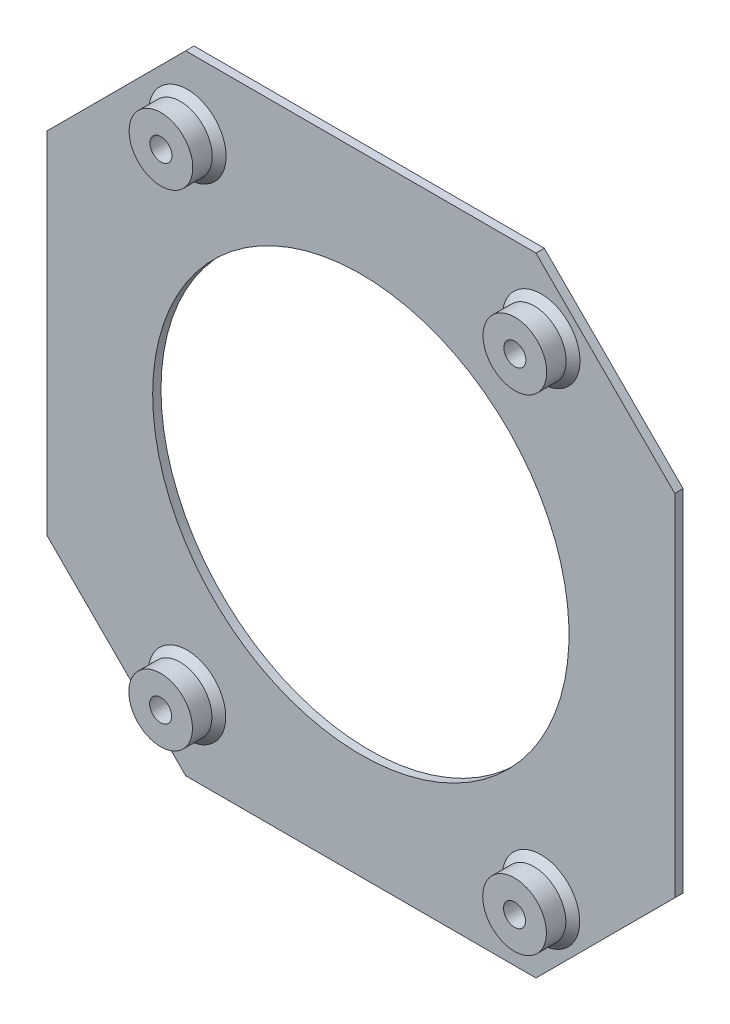
from build123d import *

# Parameters (mm, degrees)
SKETCH2_W           = 90.475
SKETCH2_H           = 1.2
BOSS_EXTRUDE1_DEPTH = 90.475
SKETCH3_R           = 4.587496825
SKETCH3_R_2         = 1.587496825
EXTRUDE_THIN1_DEPTH = 3.8
CHAMFER1_SIZE       = 1
SKETCH5_R           = 30
CUT_EXTRUDE1_DEPTH  = 106.553838455
CHAMFER2_SIZE       = 20


with BuildPart() as part:
    # Sketch2 → Boss-Extrude1 (new body)
    with BuildSketch(Plane(origin=(0, 4.7625, 0), x_dir=(1, 0, 0), z_dir=(0, 1, 0))):
        with Locations((0, -0.6)):
            Rectangle(SKETCH2_W, SKETCH2_H)
    extrude(amount=BOSS_EXTRUDE1_DEPTH)

    # Sketch3 → Extrude-Thin1 (add)
    # profile 1 of 4: a face of its own
    with BuildSketch(Plane(origin=(0, 0, 5), x_dir=(-1, 0, 0), z_dir=(0, 0, -1))):
        with Locations((25.003889322, 84.960201446)):
            Circle(SKETCH3_R)
        with Locations((25.003889322, 84.960201446)):
            Circle(SKETCH3_R_2, mode=Mode.SUBTRACT)
    # profile 2 of 4: a face of its own
    with BuildSketch(Plane(origin=(0, 0, 5), x_dir=(-1, 0, 0), z_dir=(0, 0, -1))):
        with Locations((-25.995997859, 84.926982308)):
            Circle(SKETCH3_R)
        with Locations((-25.995997859, 84.926982308)):
            Circle(SKETCH3_R_2, mode=Mode.SUBTRACT)
    # profile 3 of 4: a face of its own
    with BuildSketch(Plane(origin=(0, 0, 5), x_dir=(-1, 0, 0), z_dir=(0, 0, -1))):
        with Locations((25.049484218, 14.960356296)):
            Circle(SKETCH3_R)
        with Locations((25.049484218, 14.960356296)):
            Circle(SKETCH3_R_2, mode=Mode.SUBTRACT)
    # profile 4 of 4: a face of its own
    with BuildSketch(Plane(origin=(0, 0, 5), x_dir=(-1, 0, 0), z_dir=(0, 0, -1))):
        with Locations((-25.950402964, 14.927137158)):
            Circle(SKETCH3_R)
        with Locations((-25.950402964, 14.927137158)):
            Circle(SKETCH3_R_2, mode=Mode.SUBTRACT)
    extrude(amount=EXTRUDE_THIN1_DEPTH)

    # Chamfer1
    chamfer1_edges = [part.edges().sort_by_distance(p)[0] for p in [
        (-20.416392497, 84.960201446, 1.2),
        (30.583494684, 84.926982308, 1.2),
        (-20.461987393, 14.960356296, 1.2),
        (30.537899789, 14.927137158, 1.2),
    ]]
    chamfer(chamfer1_edges, length=CHAMFER1_SIZE)

    # Sketch5 → Cut-Extrude1 (cut, through all)
    with BuildSketch(Plane(origin=(0, 0, 0), x_dir=(-1, 0, 0), z_dir=(0, 0, -1))):
        with Locations((0, 50)):
            Circle(SKETCH5_R)
    extrude(amount=-CUT_EXTRUDE1_DEPTH, mode=Mode.SUBTRACT)

    # Chamfer2
    chamfer2_edges = [part.edges().sort_by_distance(p)[0] for p in [
        (-45.2375, 95.2375, 0.6),
        (45.2375, 95.2375, 0.6),
        (-45.2375, 4.7625, 0.6),
        (45.2375, 4.7625, 0.6),
    ]]
    chamfer(chamfer2_edges, length=CHAMFER2_SIZE)


solid = part.part
